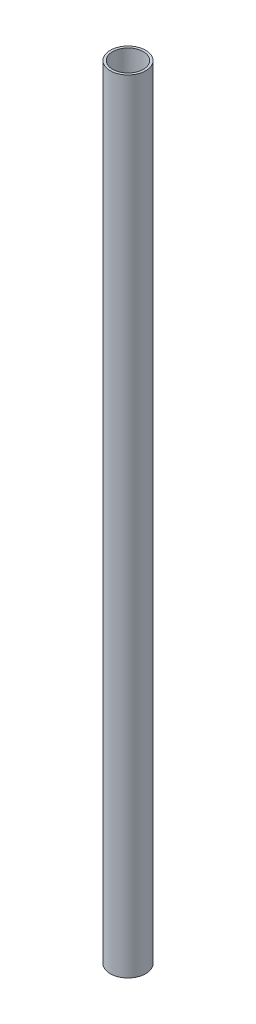
from build123d import *

# Parameters (mm, degrees)
SKETCH1_R           = 15
SKETCH1_R_2         = 13
BOSS_EXTRUDE1_DEPTH = 661


with BuildPart() as part:
    # Sketch1 → Boss-Extrude1 (new body)
    with BuildSketch(Plane(origin=(0, 0, 0), x_dir=(1, 0, 0), z_dir=(0, 1, 0))):
        with Locations(Location((0, 0, 0), (0, 0, 270))):
            Circle(SKETCH1_R)
        with Locations(Location((0, 0, 0), (0, 0, 270))):
            Circle(SKETCH1_R_2, mode=Mode.SUBTRACT)
    extrude(amount=BOSS_EXTRUDE1_DEPTH)


solid = part.part
